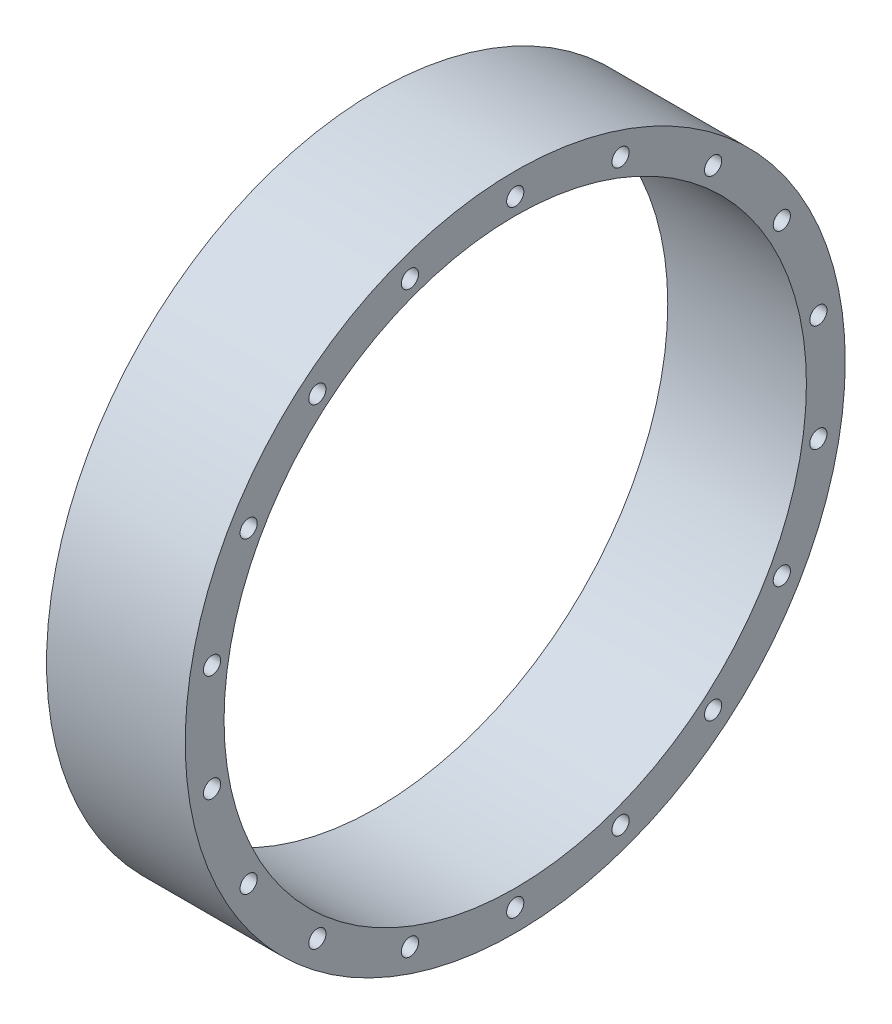
from build123d import *

# Parameters (mm, degrees)
SKETCH_1_R               = 59.5
SKETCH_1_R_2             = 52.5
EXTRUDE_1_DEPTH          = 25
SKETCH_2_R               = 1.55
CUT_EXTRUDE_1_DEPTH      = 88.780977438
PATTERN_CIRCULAR_1_COUNT = 18


with BuildPart() as part:
    # 草图1 → 凸台-拉伸1 (new body)
    with BuildSketch(Plane(origin=(0, 0, 0), x_dir=(0, 0, -1), z_dir=(1, 0, 0))):
        Circle(SKETCH_1_R)
        Circle(SKETCH_1_R_2, mode=Mode.SUBTRACT)
    extrude(amount=EXTRUDE_1_DEPTH)

    # 草图2 → 切除-拉伸1 (cut, through all)
    with BuildSketch(Plane(origin=(25, 0, 0), x_dir=(0, 0, -1), z_dir=(1, 0, 0))):
        with Locations((0, 55.5)):
            Circle(SKETCH_2_R)
    cut_extrude_1 = extrude(amount=-CUT_EXTRUDE_1_DEPTH, mode=Mode.SUBTRACT)

    # 阵列(圆周)1: 切除-拉伸1 ×18 about axis
    pattern_circular_1_axis = Axis((0, 0, 0), (1, 0, 0))
    for i in range(1, PATTERN_CIRCULAR_1_COUNT):
        add(cut_extrude_1.rotate(pattern_circular_1_axis, i * 360 / PATTERN_CIRCULAR_1_COUNT), mode=Mode.SUBTRACT)


solid = part.part
